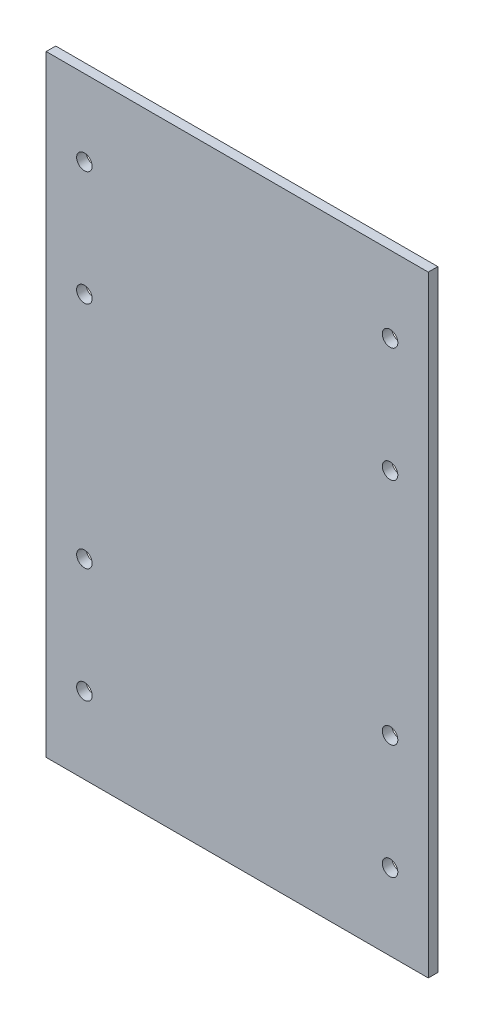
from build123d import *

# Parameters (mm, degrees)
SKETCH1_W           = 127
SKETCH1_H           = 203.2
BOSS_EXTRUDE1_DEPTH = 3.175
SKETCH2_R           = 2.5796875
CUT_EXTRUDE1_DEPTH  = 6.35


with BuildPart() as part:
    # Sketch1 → Boss-Extrude1 (new body)
    with BuildSketch(Plane.XY):
        Rectangle(SKETCH1_W, SKETCH1_H)
    extrude(amount=BOSS_EXTRUDE1_DEPTH)

    # Sketch2 → Cut-Extrude1 (cut)
    with BuildSketch(Plane.XY.offset(3.175)):
        with Locations((-50.8, 76.2)):
            Circle(SKETCH2_R)
        with Locations((-50.8, 38.1)):
            Circle(SKETCH2_R)
        with Locations((-50.8, -38.1)):
            Circle(SKETCH2_R)
        with Locations((-50.8, -76.2)):
            Circle(SKETCH2_R)
    cut_extrude1 = extrude(amount=-CUT_EXTRUDE1_DEPTH, mode=Mode.SUBTRACT)

    # Mirror1: Cut-Extrude1 across plane
    add(cut_extrude1.mirror(Plane(origin=(0, 0, 0), x_dir=(0, 0, 1), z_dir=(1, 0, 0))), mode=Mode.SUBTRACT)


solid = part.part
